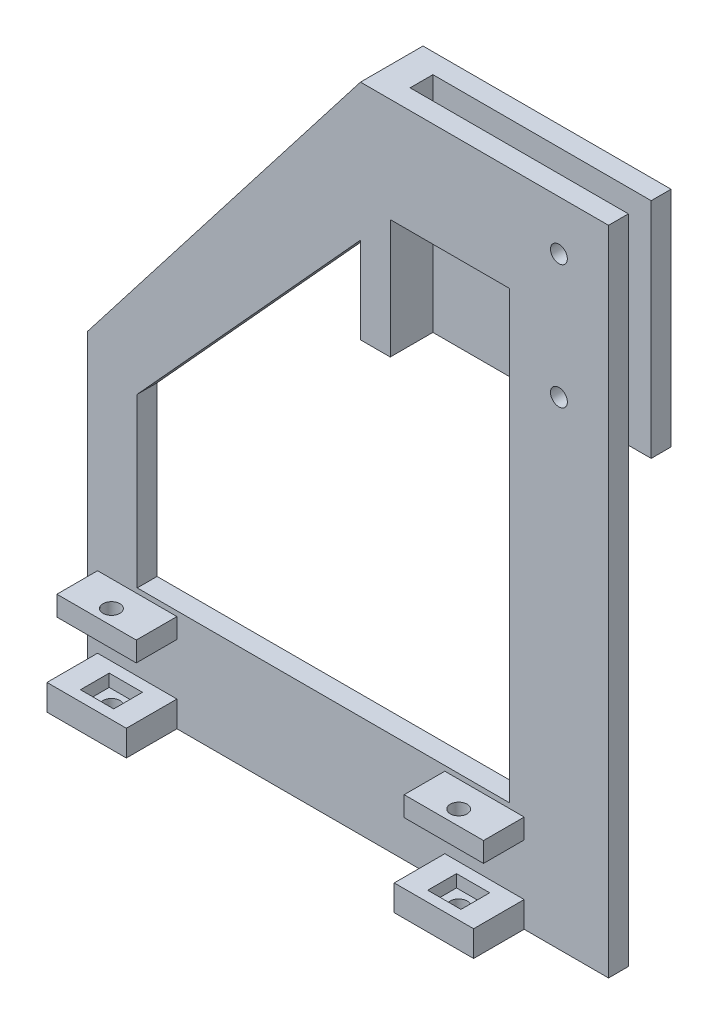
from build123d import *

# Parameters (mm, degrees)
EXTRUDE_START                = -4.2
EXTRUDE_312_DEPTH            = 4
CUT_EXTRUDE_453_DEPTH        = 142.840191765
CUT_EXTRUDE_453_DEPTH_BACK   = 142.840191765
SKETCH_3_W                   = 16
SKETCH_3_H                   = 4
EXTRUDE_645_DEPTH            = 12.2
SKETCH_4_W                   = 16
SKETCH_4_H                   = 2.7
EXTRUDE_847_DEPTH            = 14.2
EXTRUDE_START_2              = -2.7
SKETCH_5_W                   = 16
SKETCH_5_H                   = 14.2
SKETCH_5_W_2                 = 6.7
SKETCH_5_H_2                 = 5.8
EXTRUDE_M3_DEPTH             = 2.5
EXTRUDE_START_3              = -12.8
SKETCH_6_W                   = 6
SKETCH_6_H                   = 45
EXTRUDE_1324_DEPTH           = 12.6
SKETCH_7_W                   = 50
SKETCH_7_H                   = 45
EXTRUDE_1468_DEPTH           = 4
CUT_EXTRUDE_3P4_DEPTH        = 143.354627603
CUT_EXTRUDE_3P4_DEPTH_BACK   = 143.354627603
SKETCH_8_R                   = 1.7
CUT_EXTRUDE_3P4_2_DEPTH      = 143.354627603
CUT_EXTRUDE_3P4_2_DEPTH_BACK = 143.354627603
SKETCH_9_R                   = 1.7


with BuildPart() as part:
    # 草图1 → Extrude 312 (new body)
    with BuildSketch(Plane.XY.offset(EXTRUDE_START)):
        Polygon((-65, -5.4), (40, -5.4), (40, 126), (-10, 126), (-65, 55), align=None)
    extrude(amount=EXTRUDE_312_DEPTH)

    # 草图2 → Cut-Extrude 453 (cut, two sides: drawn at the far end of the back side and taken through both)
    with BuildSketch(Plane.XY.offset(-CUT_EXTRUDE_453_DEPTH_BACK)):
        Polygon((-55, 15.2), (20, 15.2), (20, 105), (-4, 105), (-55, 49), align=None)
    extrude(amount=CUT_EXTRUDE_453_DEPTH + CUT_EXTRUDE_453_DEPTH_BACK, mode=Mode.SUBTRACT)

    # 草图3 → Extrude 645 (add)
    with BuildSketch(Plane.XY.offset(EXTRUDE_START)):
        with Locations((-55, 12.2)):
            Rectangle(SKETCH_3_W, SKETCH_3_H)
        with Locations((15, 12.2)):
            Rectangle(SKETCH_3_W, SKETCH_3_H)
    extrude(amount=EXTRUDE_645_DEPTH)

    # 草图4 → Extrude 847 (add)
    with BuildSketch(Plane.XY.offset(EXTRUDE_START)):
        with Locations((-55, -4.05)):
            Rectangle(SKETCH_4_W, SKETCH_4_H)
        with Locations((15, -4.05)):
            Rectangle(SKETCH_4_W, SKETCH_4_H)
    extrude(amount=EXTRUDE_847_DEPTH)

    # 草图5 → 下卡唇M3螺母防转槽 (add)
    # profile 1 of 2: a face of its own
    with BuildSketch(Plane(origin=(0, 0, 0), x_dir=(1, 0, 0), z_dir=(0, 1, 0)).offset(EXTRUDE_START_2)):
        with Locations((-55, -2.9)):
            Rectangle(SKETCH_5_W, SKETCH_5_H)
        with Locations((-55, -5)):
            Rectangle(SKETCH_5_W_2, SKETCH_5_H_2, mode=Mode.SUBTRACT)
    # profile 2 of 2: a face of its own
    with BuildSketch(Plane(origin=(0, 0, 0), x_dir=(1, 0, 0), z_dir=(0, 1, 0)).offset(EXTRUDE_START_2)):
        with Locations((15, -2.9)):
            Rectangle(SKETCH_5_W, SKETCH_5_H)
        with Locations((15, -5)):
            Rectangle(SKETCH_5_W_2, SKETCH_5_H_2, mode=Mode.SUBTRACT)
    extrude(amount=EXTRUDE_M3_DEPTH)

    # 草图6 → Extrude 1324 (add)
    with BuildSketch(Plane.XY.offset(EXTRUDE_START_3)):
        with Locations((-7, 103.5)):
            Rectangle(SKETCH_6_W, SKETCH_6_H)
    extrude(amount=EXTRUDE_1324_DEPTH)

    # 草图7 → Extrude 1468 (add)
    with BuildSketch(Plane.XY.offset(EXTRUDE_START_3)):
        with Locations((15, 103.5)):
            Rectangle(SKETCH_7_W, SKETCH_7_H)
    extrude(amount=EXTRUDE_1468_DEPTH)

    # 草图8 → Cut-Extrude 3p4 (cut, two sides: drawn at the far end of the back side and taken through both)
    with BuildSketch(Plane.XY.offset(-CUT_EXTRUDE_3P4_DEPTH_BACK)):
        with Locations((30, 91)):
            Circle(SKETCH_8_R)
        with Locations((30, 116)):
            Circle(SKETCH_8_R)
    extrude(amount=CUT_EXTRUDE_3P4_DEPTH + CUT_EXTRUDE_3P4_DEPTH_BACK, mode=Mode.SUBTRACT)

    # 草图9 → Cut-Extrude 3p4 2 (cut, two sides: drawn at the far end of the back side and taken through both)
    with BuildSketch(Plane(origin=(0, 0, 0), x_dir=(1, 0, 0), z_dir=(0, 1, 0)).offset(-CUT_EXTRUDE_3P4_2_DEPTH_BACK)):
        with Locations(Location((-55, -5, 0), (0, 0, 270))):
            Circle(SKETCH_9_R)
        with Locations(Location((15, -5, 0), (0, 0, 270))):
            Circle(SKETCH_9_R)
    extrude(amount=CUT_EXTRUDE_3P4_2_DEPTH + CUT_EXTRUDE_3P4_2_DEPTH_BACK, mode=Mode.SUBTRACT)


solid = part.part
